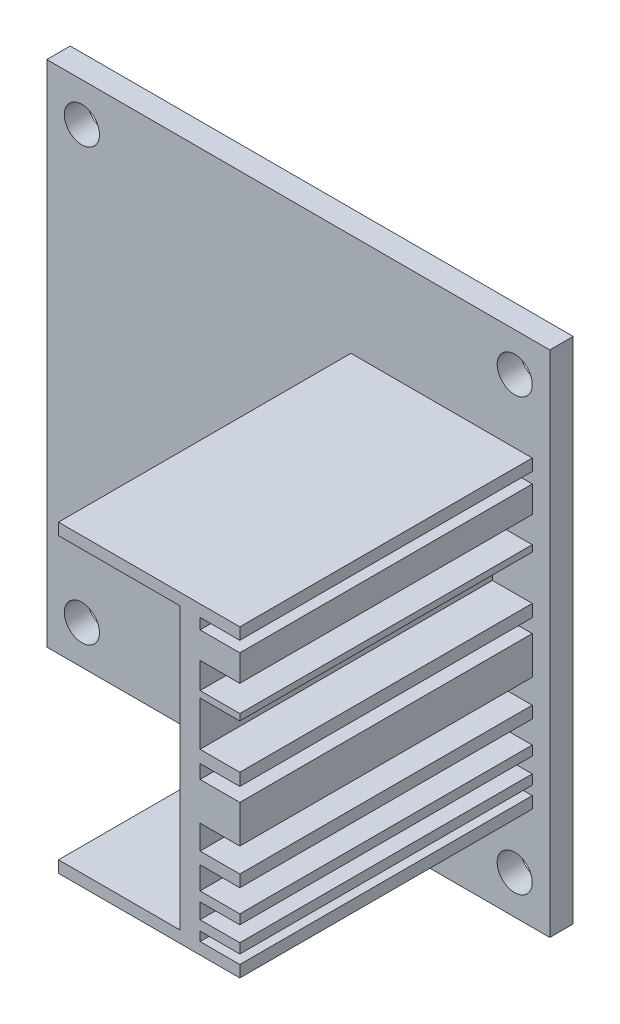
from build123d import *

# Parameters (mm, degrees)
SKETCH_1_W          = 43
SKETCH_1_H          = 43.5
SKETCH_1_R          = 1.5
EXTRUDE_1_DEPTH     = 2
SKETCH_2_W          = 15.5
SKETCH_2_H          = 26
EXTRUDE_2_DEPTH     = 25
SKETCH_3_W          = 10.4
SKETCH_3_H          = 24
SKETCH_3_W_2        = 3.4
SKETCH_3_H_2        = 0.926804748
SKETCH_3_H_3        = 0.774498031
SKETCH_3_H_4        = 2.236086948
SKETCH_3_H_5        = 3.79712878
SKETCH_3_H_6        = 1.178452045
SKETCH_3_H_7        = 1.322605193
SKETCH_3_H_8        = 1.93303836
SKETCH_3_H_9        = 2.068690175
CUT_EXTRUDE_1_DEPTH = 25


with BuildPart() as part:
    # 草图1 → 凸台-拉伸1 (new body)
    with BuildSketch(Plane.XY):
        Rectangle(SKETCH_1_W, SKETCH_1_H)
        with Locations((-18.5, 18.431705674)):
            Circle(SKETCH_1_R, mode=Mode.SUBTRACT)
        with Locations(Location((18.5, -18.431705674, 0), (0, 0, 180))):
            Circle(SKETCH_1_R, mode=Mode.SUBTRACT)
        with Locations(Location((-18.5, -18.431705674, 0), (0, 0, 180))):
            Circle(SKETCH_1_R, mode=Mode.SUBTRACT)
        with Locations((18.5, 18.431705674)):
            Circle(SKETCH_1_R, mode=Mode.SUBTRACT)
    extrude(amount=EXTRUDE_1_DEPTH)

    # 草图2 → 凸台-拉伸2 (add)
    with BuildSketch(Plane.XY.offset(2)):
        with Locations((12.25, 0)):
            Rectangle(SKETCH_2_W, SKETCH_2_H)
    extrude(amount=EXTRUDE_2_DEPTH)

    # 草图3 → 切除-拉伸1 (cut)
    with BuildSketch(Plane.XY.offset(27)):
        with Locations((9.7, 0)):
            Rectangle(SKETCH_3_W, SKETCH_3_H)
        with Locations((18.3, 11.536597626)):
            Rectangle(SKETCH_3_W_2, SKETCH_3_H_2)
        with Locations((18.3, -11.612750984)):
            Rectangle(SKETCH_3_W_2, SKETCH_3_H_3)
        with Locations((18.3, 7.69685645)):
            Rectangle(SKETCH_3_W_2, SKETCH_3_H_4)
        with Locations((18.3, 4.131774429)):
            Rectangle(SKETCH_3_W_2, SKETCH_3_H_5)
        with Locations((18.3, 0.589226023)):
            Rectangle(SKETCH_3_W_2, SKETCH_3_H_6)
        with Locations((18.3, -9.727346991)):
            Rectangle(SKETCH_3_W_2, SKETCH_3_H_7)
        with Locations((18.3, -7.285614326)):
            Rectangle(SKETCH_3_W_2, SKETCH_3_H_8)
        with Locations((18.3, -4.267361447)):
            Rectangle(SKETCH_3_W_2, SKETCH_3_H_9)
    extrude(amount=-CUT_EXTRUDE_1_DEPTH, mode=Mode.SUBTRACT)


solid = part.part
